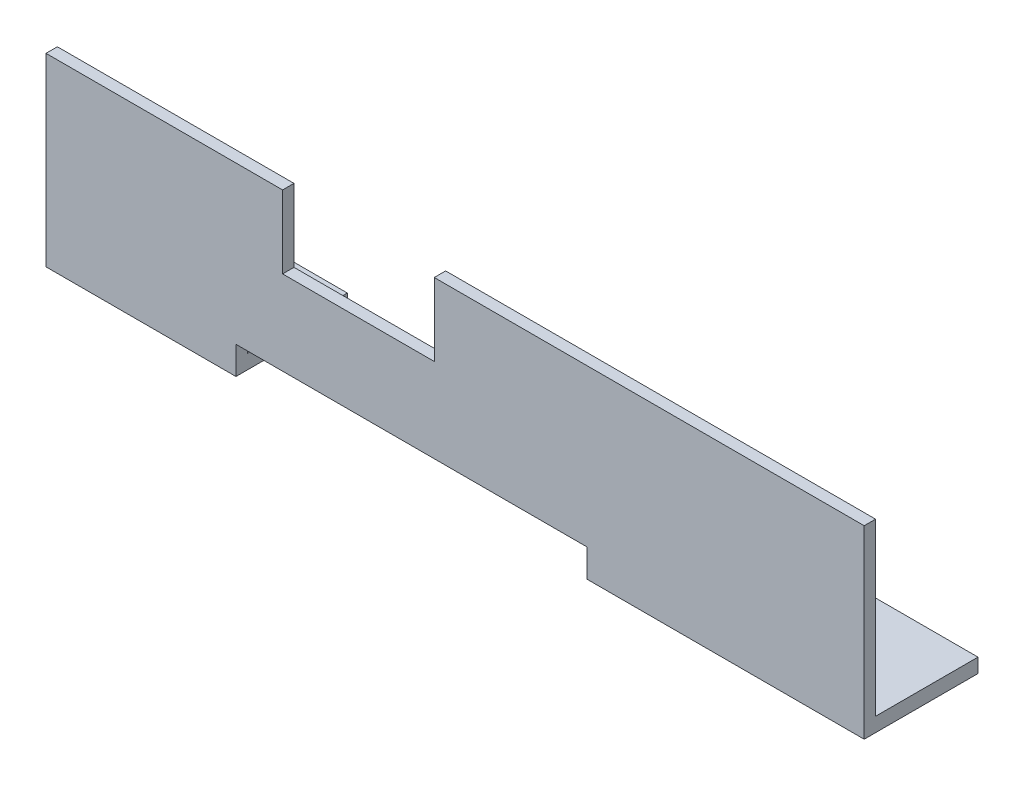
from build123d import *

# Parameters (mm, degrees)
EXTRUDE_1_DEPTH     = 287.576527547
CUT_EXTRUDE_START   = -20
SKETCH_2_W          = 123.460031058
SKETCH_2_H          = 15.574638679
CUT_EXTRUDE_1_DEPTH = 277.47977873
SKETCH_3_W          = 53.30442173
SKETCH_3_H          = 30.05092592
CUT_EXTRUDE_2_DEPTH = 40
SKETCH_4_W          = 88.57938219
SKETCH_4_H          = 6.982300606
CUT_EXTRUDE_3_DEPTH = 296.966652169


with BuildPart() as part:
    # Эскиз1 → Вытянуть1 (new body)
    with BuildSketch(Plane(origin=(0, 0, 0), x_dir=(0, 0, -1), z_dir=(1, 0, 0))):
        Polygon((0, 0), (0, 60), (-4, 60), (-4, -5), (36, -5), (36, 0), align=None)
    extrude(amount=EXTRUDE_1_DEPTH)

    # Эскиз2 → Вырез-Вытянуть1 (cut, through all)
    with BuildSketch(Plane(origin=(0, 0, -36), x_dir=(-1, 0, 0), z_dir=(0, 0, -1)).offset(CUT_EXTRUDE_START)):
        with Locations((-128.492748506, -2.9676861)):
            Rectangle(SKETCH_2_W, SKETCH_2_H)
    extrude(amount=-CUT_EXTRUDE_1_DEPTH, mode=Mode.SUBTRACT)

    # Эскиз3 → Вырез-Вытянуть2 (cut)
    with BuildSketch(Plane(origin=(0, 0, 0), x_dir=(-1, 0, 0), z_dir=(0, 0, -1))):
        with Locations((-109.814559779, 49.461309937)):
            Rectangle(SKETCH_3_W, SKETCH_3_H)
    extrude(amount=-CUT_EXTRUDE_2_DEPTH, mode=Mode.SUBTRACT)

    # Эскиз4 → Вырез-Вытянуть3 (cut, through all)
    with BuildSketch(Plane(origin=(0, 0, 0), x_dir=(1, 0, 0), z_dir=(0, 1, 0))):
        with Locations((110.214944544, 33.390941069)):
            Rectangle(SKETCH_4_W, SKETCH_4_H)
    extrude(amount=-CUT_EXTRUDE_3_DEPTH, mode=Mode.SUBTRACT)


solid = part.part
